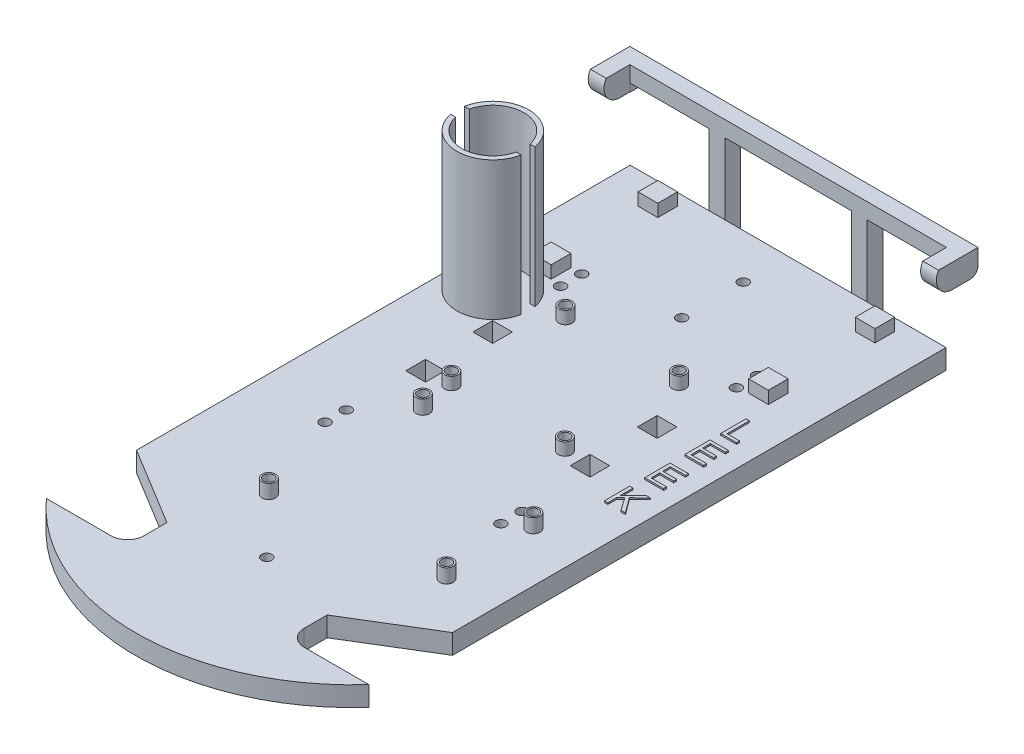
from build123d import *

# Parameters (mm, degrees)
BOSS_EXTRUDE1_DEPTH      = 6.35
SKETCH3_W                = 5.08
SKETCH3_H                = 29.21
BOSS_EXTRUDE2_DEPTH      = 5.08
BOSS_EXTRUDE3_DEPTH      = 5.08
BOSS_EXTRUDE4_START      = -5.08
BOSS_EXTRUDE4_DEPTH      = 5.08
FILLET1_R                = 2.54
BOSS_EXTRUDE5_DEPTH      = 0.508
SKETCH8_R                = 1.651
CUT_EXTRUDE1_DEPTH       = 238.044604696
SKETCH9_W                = 6.35
SKETCH9_H                = 6.35
CUT_EXTRUDE3_DEPTH       = 238.044604696
SKETCH10_R               = 1.651
CUT_EXTRUDE4_DEPTH       = 238.044604696
SKETCH12_R               = 1.651
CUT_EXTRUDE6_DEPTH       = 238.044604696
BOSS_EXTRUDE7_START      = 4
SKETCH10_3_R             = 2.159
SKETCH10_3_R_2           = 1.651
BOSS_EXTRUDE7_DEPTH      = 4
BOSS_EXTRUDE8_START      = 4.5
SKETCH12_3_R             = 2.159
SKETCH12_3_R_2           = 1.651
BOSS_EXTRUDE8_DEPTH      = 4.5
SKETCH18_W               = 6.35
SKETCH18_H               = 6.35
BOSS_EXTRUDE9_DEPTH      = 4
SKETCH18_3_R             = 1.651
CUT_EXTRUDE11_DEPTH      = 238.044604696
SKETCH17_R               = 1.651
CUT_EXTRUDE10_DEPTH      = 238.044604696
SKETCH19_R               = 11.557
BOSS_EXTRUDE11_DEPTH     = 44.45
CUT_EXTRUDE12_DEPTH      = 44.45
CUT_EXTRUDE13_DEPTH      = 241.811422103
CUT_EXTRUDE13_DEPTH_BACK = 44.45


with BuildPart() as part:
    # Sketch2 → Boss-Extrude1 (new body)
    with BuildSketch(Plane(origin=(0, 0, 0), x_dir=(1, 0, 0), z_dir=(0, 1, 0))):
        with BuildLine():
            Line((0, 0), (101.6, 0))
            Line((101.6, 0), (101.6, -158.75))
            Line((101.6, -158.75), (76.564326768, -173.99))
            Line((76.564326768, -173.99), (76.564326768, -181.382171521))
            ThreePointArc((76.564326768, -181.382171521), (78.118953736, -185.135373032), (81.872155247, -186.69))
            Line((81.872155247, -186.69), (102.6439366, -186.69))
            ThreePointArc((102.6439366, -186.69), (50.8, -209.778175447), (-1.0439366, -186.69))
            Line((-1.0439366, -186.69), (19.727844753, -186.69))
            ThreePointArc((19.727844753, -186.69), (23.481046264, -185.135373032), (25.035673232, -181.382171521))
            Line((25.035673232, -181.382171521), (25.035673232, -173.99))
            Line((25.035673232, -173.99), (0, -158.75))
            Line((0, -158.75), (0, 0))
        make_face()
    extrude(amount=-BOSS_EXTRUDE1_DEPTH)

    # Sketch3 → Boss-Extrude2 (add)
    with BuildSketch(Plane(origin=(0, 0, 0), x_dir=(-1, 0, 0), z_dir=(0, 0, -1))):
        with Locations((-73.66, 8.255)):
            Rectangle(SKETCH3_W, SKETCH3_H)
        with Locations((-27.94, 8.255)):
            Rectangle(SKETCH3_W, SKETCH3_H)
        Polygon((-101.6, 22.86), (0, 22.86), (0, 20.32), (5.183042295, 20.32), (5.183042295, 27.94), (-106.783042295, 27.94), (-106.783042295, 20.32), (-101.6, 20.32), align=None)
    extrude(amount=BOSS_EXTRUDE2_DEPTH)

    # Sketch5 → Boss-Extrude3 (add)
    with BuildSketch(Plane(origin=(106.783042295, 0, 0), x_dir=(0, 0, -1), z_dir=(1, 0, 0))):
        with BuildLine():
            Line((5.08, 20.32), (5.08, 27.94))
            Line((5.08, 27.94), (-7.62, 27.94))
            ThreePointArc((-7.62, 27.94), (-7.62, 22.86), (-3.220590949, 20.32))
            Line((-3.220590949, 20.32), (5.08, 20.32))
        make_face()
    extrude(amount=-BOSS_EXTRUDE3_DEPTH)

    # Sketch6 → Boss-Extrude4 (add)
    with BuildSketch(Plane.ZY.offset(5.183042295).offset(BOSS_EXTRUDE4_START)):
        with BuildLine():
            Line((-5.08, 27.94), (-5.08, 20.32))
            Line((-5.08, 20.32), (3.220590949, 20.32))
            ThreePointArc((3.220590949, 20.32), (7.62, 22.86), (7.62, 27.94))
            Line((7.62, 27.94), (-5.08, 27.94))
        make_face()
    extrude(amount=BOSS_EXTRUDE4_DEPTH)

    # Fillet1
    fillet1_edges = [part.edges().sort_by_distance(p)[0] for p in [
        (104.191521148, 20.32, -5.08),
        (-2.591521148, 20.32, -5.08),
    ]]
    fillet(fillet1_edges, radius=FILLET1_R)

    # Sketch7 → Boss-Extrude5 (add)
    with BuildSketch(Plane(origin=(0, 0, 0), x_dir=(1, 0, 0), z_dir=(0, 1, 0))):
        Polygon((89.799496033, -60.676992934), (89.78467881, -52.5308129), (90.863043386, -52.529166542), (90.876214251, -59.713873427), (94.888389017, -59.707287995), (94.890035375, -60.668761144), align=None)
        Polygon((89.879733483, -72.309493974), (89.864916259, -64.16331394), (95.753939295, -64.153435791), (95.755585653, -65.11490894), (90.944927194, -65.123140731), (90.949866268, -67.6173733), (95.455948473, -67.609141509), (95.457594832, -68.565675583), (90.951512626, -68.573907374), (90.956451701, -71.346374467), (95.956441345, -71.338142677), (95.958087704, -72.299615825), align=None)
        Polygon((89.89385468, -85.206397301), (89.879037456, -77.060217267), (95.768060492, -77.050339118), (95.76970685, -78.011812267), (90.959048391, -78.020044058), (90.963987465, -80.514276627), (95.470069671, -80.506044836), (95.471716029, -81.46257891), (90.965633823, -81.470810701), (90.970572898, -84.243277794), (95.970562542, -84.235046003), (95.972208901, -85.196519152), align=None)
        Polygon((89.840475193, -98.103300628), (89.82565797, -89.957120594), (90.904022546, -89.955474236), (90.912254337, -93.99563709), (94.949124475, -89.948888803), (96.411090496, -89.945596087), (92.999836447, -93.253129573), (96.575726309, -98.091776121), (95.153272883, -98.095068837), (92.245804423, -93.977527151), (90.913900695, -95.278150074), (90.918839769, -98.10165427), align=None)
    extrude(amount=BOSS_EXTRUDE5_DEPTH)

    # Sketch8 → Cut-Extrude1 (cut, through all)
    with BuildSketch(Plane(origin=(0, 0, 0), x_dir=(1, 0, 0), z_dir=(0, 1, 0))):
        with Locations(Location((79.0702, -38.1, 0), (0, 0, 270))):
            Circle(SKETCH8_R)
        with Locations(Location((79.0702, -44.9072, 0), (0, 0, 270))):
            Circle(SKETCH8_R)
        with Locations(Location((79.0702, -113.8428, 0), (0, 0, 90))):
            Circle(SKETCH8_R)
        with Locations(Location((79.0702, -120.65, 0), (0, 0, 90))):
            Circle(SKETCH8_R)
        with Locations(Location((22.5298, -44.9072, 0), (0, 0, 90))):
            Circle(SKETCH8_R)
        with Locations(Location((22.5298, -38.1, 0), (0, 0, 90))):
            Circle(SKETCH8_R)
        with Locations(Location((22.5298, -113.8428, 0), (0, 0, 270))):
            Circle(SKETCH8_R)
        with Locations(Location((22.5298, -120.65, 0), (0, 0, 270))):
            Circle(SKETCH8_R)
    extrude(amount=-CUT_EXTRUDE1_DEPTH, mode=Mode.SUBTRACT)

    # Sketch9 → Cut-Extrude3 (cut, through all)
    with BuildSketch(Plane(origin=(0, 0, 0), x_dir=(1, 0, 0), z_dir=(0, 1, 0))):
        with Locations((24.357944443, -68.58)):
            Rectangle(SKETCH9_W, SKETCH9_H)
        with Locations((77.242055557, -68.58)):
            Rectangle(SKETCH9_W, SKETCH9_H)
        with Locations((24.357944443, -90.17)):
            Rectangle(SKETCH9_W, SKETCH9_H)
        with Locations((77.242055557, -90.17)):
            Rectangle(SKETCH9_W, SKETCH9_H)
    extrude(amount=-CUT_EXTRUDE3_DEPTH, mode=Mode.SUBTRACT)

    # Sketch10 → Cut-Extrude4 (cut, through all)
    with BuildSketch(Plane(origin=(0, 0, 0), x_dir=(1, 0, 0), z_dir=(0, 1, 0))):
        with Locations(Location((32.54375, -90.043, 0), (0, 0, 270))):
            Circle(SKETCH10_R)
        with Locations(Location((69.05625, -90.043, 0), (0, 0, 270))):
            Circle(SKETCH10_R)
        with Locations(Location((69.05625, -53.34, 0), (0, 0, 270))):
            Circle(SKETCH10_R)
        with Locations(Location((32.54375, -53.34, 0), (0, 0, 270))):
            Circle(SKETCH10_R)
    extrude(amount=-CUT_EXTRUDE4_DEPTH, mode=Mode.SUBTRACT)

    # Sketch12 → Cut-Extrude6 (cut, through all)
    with BuildSketch(Plane(origin=(0, 0, 0), x_dir=(1, 0, 0), z_dir=(0, 1, 0))):
        with Locations(Location((33.528, -149.734072737, 0), (0, 0, 270))):
            Circle(SKETCH12_R)
        with Locations(Location((85.598, -144.653, 0), (0, 0, 270))):
            Circle(SKETCH12_R)
        with Locations(Location((85.598, -116.713, 0), (0, 0, 270))):
            Circle(SKETCH12_R)
        with Locations(Location((34.798, -101.473, 0), (0, 0, 270))):
            Circle(SKETCH12_R)
    extrude(amount=-CUT_EXTRUDE6_DEPTH, mode=Mode.SUBTRACT)

    # Sketch10<3> → Boss-Extrude7 (add)
    # profile 1 of 4: a face of its own
    with BuildSketch(Plane(origin=(0, 0, 0), x_dir=(1, 0, 0), z_dir=(0, 1, 0)).offset(BOSS_EXTRUDE7_START)):
        with Locations(Location((69.05625, -53.34, 0), (0, 0, 90))):
            Circle(SKETCH10_3_R)
        with Locations(Location((69.05625, -53.34, 0), (0, 0, 270))):
            Circle(SKETCH10_3_R_2, mode=Mode.SUBTRACT)
    # profile 2 of 4: a face of its own
    with BuildSketch(Plane(origin=(0, 0, 0), x_dir=(1, 0, 0), z_dir=(0, 1, 0)).offset(BOSS_EXTRUDE7_START)):
        with Locations(Location((69.05625, -90.043, 0), (0, 0, 90))):
            Circle(SKETCH10_3_R)
        with Locations(Location((69.05625, -90.043, 0), (0, 0, 270))):
            Circle(SKETCH10_3_R_2, mode=Mode.SUBTRACT)
    # profile 3 of 4: a face of its own
    with BuildSketch(Plane(origin=(0, 0, 0), x_dir=(1, 0, 0), z_dir=(0, 1, 0)).offset(BOSS_EXTRUDE7_START)):
        with Locations(Location((32.54375, -53.34, 0), (0, 0, 90))):
            Circle(SKETCH10_3_R)
        with Locations(Location((32.54375, -53.34, 0), (0, 0, 270))):
            Circle(SKETCH10_3_R_2, mode=Mode.SUBTRACT)
    # profile 4 of 4: a face of its own
    with BuildSketch(Plane(origin=(0, 0, 0), x_dir=(1, 0, 0), z_dir=(0, 1, 0)).offset(BOSS_EXTRUDE7_START)):
        with Locations(Location((32.54375, -90.043, 0), (0, 0, 90))):
            Circle(SKETCH10_3_R)
        with Locations(Location((32.54375, -90.043, 0), (0, 0, 270))):
            Circle(SKETCH10_3_R_2, mode=Mode.SUBTRACT)
    extrude(amount=-BOSS_EXTRUDE7_DEPTH)

    # Sketch12<3> → Boss-Extrude8 (add)
    # profile 1 of 4: a face of its own
    with BuildSketch(Plane(origin=(0, 0, 0), x_dir=(1, 0, 0), z_dir=(0, 1, 0)).offset(BOSS_EXTRUDE8_START)):
        with Locations(Location((34.798, -101.473, 0), (0, 0, 90))):
            Circle(SKETCH12_3_R)
        with Locations(Location((34.798, -101.473, 0), (0, 0, 270))):
            Circle(SKETCH12_3_R_2, mode=Mode.SUBTRACT)
    # profile 2 of 4: a face of its own
    with BuildSketch(Plane(origin=(0, 0, 0), x_dir=(1, 0, 0), z_dir=(0, 1, 0)).offset(BOSS_EXTRUDE8_START)):
        with Locations(Location((85.598, -116.713, 0), (0, 0, 90))):
            Circle(SKETCH12_3_R)
        with Locations(Location((85.598, -116.713, 0), (0, 0, 270))):
            Circle(SKETCH12_3_R_2, mode=Mode.SUBTRACT)
    # profile 3 of 4: a face of its own
    with BuildSketch(Plane(origin=(0, 0, 0), x_dir=(1, 0, 0), z_dir=(0, 1, 0)).offset(BOSS_EXTRUDE8_START)):
        with Locations(Location((85.598, -144.653, 0), (0, 0, 90))):
            Circle(SKETCH12_3_R)
        with Locations(Location((85.598, -144.653, 0), (0, 0, 270))):
            Circle(SKETCH12_3_R_2, mode=Mode.SUBTRACT)
    # profile 4 of 4: a face of its own
    with BuildSketch(Plane(origin=(0, 0, 0), x_dir=(1, 0, 0), z_dir=(0, 1, 0)).offset(BOSS_EXTRUDE8_START)):
        with Locations(Location((33.528, -149.734072737, 0), (0, 0, 90))):
            Circle(SKETCH12_3_R)
        with Locations(Location((33.528, -149.734072737, 0), (0, 0, 270))):
            Circle(SKETCH12_3_R_2, mode=Mode.SUBTRACT)
    extrude(amount=-BOSS_EXTRUDE8_DEPTH)

    # Sketch18 → Boss-Extrude9 (add)
    with BuildSketch(Plane(origin=(0, 0, 0), x_dir=(1, 0, 0), z_dir=(0, 1, 0))):
        with Locations((15.875, -6.985)):
            Rectangle(SKETCH18_W, SKETCH18_H)
        with Locations((85.725, -6.985)):
            Rectangle(SKETCH18_W, SKETCH18_H)
        with Locations((85.725, -41.275)):
            Rectangle(SKETCH18_W, SKETCH18_H)
        with Locations((15.875, -41.275)):
            Rectangle(SKETCH18_W, SKETCH18_H)
    extrude(amount=BOSS_EXTRUDE9_DEPTH)

    # Sketch18<3> → Cut-Extrude11 (cut, through all)
    with BuildSketch(Plane(origin=(0, 0, 0), x_dir=(1, 0, 0), z_dir=(0, 1, 0))):
        with Locations(Location((50.8, -34.23412, 0), (0, 0, 270))):
            Circle(SKETCH18_3_R)
        with Locations(Location((50.74666, -14.38402, 0), (0, 0, 270))):
            Circle(SKETCH18_3_R)
    extrude(amount=-CUT_EXTRUDE11_DEPTH, mode=Mode.SUBTRACT)

    # Sketch17 → Cut-Extrude10 (cut, through all)
    with BuildSketch(Plane(origin=(0, 0, 0), x_dir=(1, 0, 0), z_dir=(0, 1, 0))):
        with Locations(Location((50.8, -167.64, 0), (0, 0, 270))):
            Circle(SKETCH17_R)
    extrude(amount=-CUT_EXTRUDE10_DEPTH, mode=Mode.SUBTRACT)

    # Sketch19 → Boss-Extrude11 (add)
    # profile 1 of 2: a face of its own
    with BuildSketch(Plane(origin=(0, 0, 0), x_dir=(1, 0, 0), z_dir=(0, 1, 0))):
        with Locations(Location((12.743693883, -56.896, 0), (0, 0, 90))):
            Circle(SKETCH19_R)
        with BuildLine():
            ThreePointArc((2.998705933, -59.117088889), (22.738593883, -56.896), (2.998705933, -54.674911111))
            Line((2.998705933, -54.674911111), (9.348705933, -54.674911111))
            Line((9.348705933, -54.674911111), (9.348705933, -59.117088889))
            Line((9.348705933, -59.117088889), (2.998705933, -59.117088889))
        make_face(mode=Mode.SUBTRACT)
    # profile 2 of 2: a face of its own
    with BuildSketch(Plane(origin=(0, 0, 0), x_dir=(1, 0, 0), z_dir=(0, 1, 0))):
        with BuildLine():
            Line((2.998705933, -59.117088889), (9.348705933, -59.117088889))
            Line((9.348705933, -59.117088889), (9.348705933, -54.674911111))
            Line((9.348705933, -54.674911111), (2.998705933, -54.674911111))
            ThreePointArc((2.998705933, -54.674911111), (22.738593883, -56.896), (2.998705933, -59.117088889))
        make_face()
    extrude(amount=BOSS_EXTRUDE11_DEPTH)

    # Sketch19<3> → Cut-Extrude12 (cut)
    with BuildSketch(Plane(origin=(0, 0, 0), x_dir=(1, 0, 0), z_dir=(0, 1, 0))):
        with BuildLine():
            Line((2.998705933, -54.674911111), (9.348705933, -54.674911111))
            Line((9.348705933, -54.674911111), (9.348705933, -59.117088889))
            Line((9.348705933, -59.117088889), (2.998705933, -59.117088889))
            ThreePointArc((2.998705933, -59.117088889), (22.738593883, -56.896), (2.998705933, -54.674911111))
        make_face()
    extrude(amount=CUT_EXTRUDE12_DEPTH, mode=Mode.SUBTRACT)

    # Sketch20 → Cut-Extrude13 (cut, two sides: drawn at the far end of the back side and taken through both)
    with BuildSketch(Plane(origin=(0, 44.45, 0), x_dir=(1, 0, 0), z_dir=(0, 1, 0)).offset(-CUT_EXTRUDE13_DEPTH_BACK)):
        with BuildLine():
            Line((9.348705933, -59.117088889), (9.348705933, -54.674911111))
            Line((9.348705933, -54.674911111), (2.998705933, -54.674911111))
            Line((2.998705933, -54.674911111), (1.402132564, -54.674911111))
            ThreePointArc((1.402132564, -54.674911111), (1.186693883, -56.896), (1.402132564, -59.117088889))
            Line((1.402132564, -59.117088889), (2.998705933, -59.117088889))
            Line((2.998705933, -59.117088889), (9.348705933, -59.117088889))
        make_face()
        with BuildLine():
            Line((16.138681834, -54.674911111), (24.085255202, -54.674911111))
            ThreePointArc((24.085255202, -54.674911111), (24.300693883, -56.896), (24.085255202, -59.117088889))
            Line((24.085255202, -59.117088889), (16.138681834, -59.117088889))
            Line((16.138681834, -59.117088889), (16.138681834, -54.674911111))
        make_face()
    extrude(amount=CUT_EXTRUDE13_DEPTH + CUT_EXTRUDE13_DEPTH_BACK, mode=Mode.SUBTRACT)


solid = part.part
